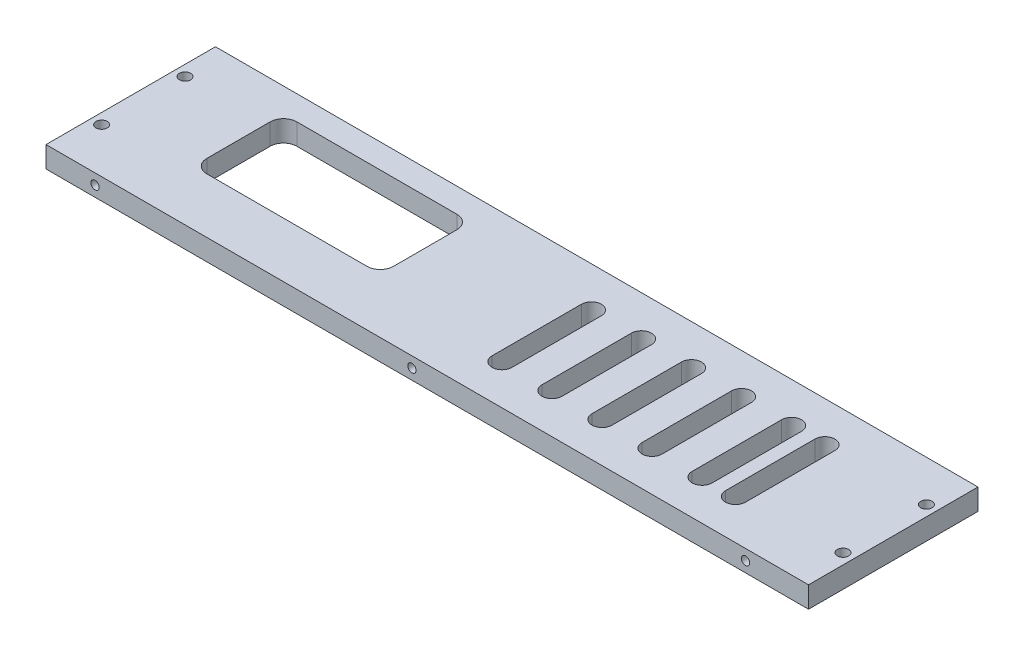
from build123d import *

# Parameters (mm, degrees)
PARED_Y_1_4IN_START          = -101.6
CROQUIS1_W                   = 228.6
CROQUIS1_H                   = 50.8
PARED_Y_1_4IN_DEPTH          = 6.35
ROSCA_M3_INFERIOR_START      = 12.7
CROQUIS2_R                   = 1.25
ROSCA_M3_INFERIOR_DEPTH      = 10
ROSCA_M3_SUPERIOR_START      = 53.5
CROQUIS3_R                   = 1.25
ROSCA_M3_SUPERIOR_DEPTH      = 10
BARRENOS_M3_ESQUINAS_START   = -101.6
CROQUIS4_R                   = 1.7
BARRENOS_M3_ESQUINAS_DEPTH   = 6.35
REFRENTADO_M3_ESQUINAS_START = -101.6
CROQUIS5_R                   = 2.9
REFRENTADO_M3_ESQUINAS_DEPTH = 3.2
VENTANA_PUERTOS_RPI5_START   = -101.6
VENTANA_PUERTOS_RPI5_DEPTH   = 6.35
RANURAS_VENTILACION_START    = -101.6
RANURAS_VENTILACION_DEPTH    = 6.35


with BuildPart() as part:
    # Croquis1 → Pared_-Y_1-4in (new body)
    with BuildSketch(Plane(origin=(0, 0, 0), x_dir=(1, 0, 0), z_dir=(0, 1, 0)).offset(PARED_Y_1_4IN_START)):
        with Locations((-25.4, -38.1)):
            Rectangle(CROQUIS1_W, CROQUIS1_H)
    extrude(amount=PARED_Y_1_4IN_DEPTH)

    # Croquis2 → Rosca_M3_inferior (cut)
    with BuildSketch(Plane.XY.offset(ROSCA_M3_INFERIOR_START)):
        with Locations((-125, -98.425)):
            Circle(CROQUIS2_R)
        with Locations((-30, -98.425)):
            Circle(CROQUIS2_R)
        with Locations((70, -98.425)):
            Circle(CROQUIS2_R)
    extrude(amount=ROSCA_M3_INFERIOR_DEPTH, mode=Mode.SUBTRACT)

    # Croquis3 → Rosca_M3_superior (cut)
    with BuildSketch(Plane.XY.offset(ROSCA_M3_SUPERIOR_START)):
        with Locations((-125, -98.425)):
            Circle(CROQUIS3_R)
        with Locations((-30, -98.425)):
            Circle(CROQUIS3_R)
        with Locations((70, -98.425)):
            Circle(CROQUIS3_R)
    extrude(amount=ROSCA_M3_SUPERIOR_DEPTH, mode=Mode.SUBTRACT)

    # Croquis4 → Barrenos_M3_esquinas (cut)
    with BuildSketch(Plane(origin=(0, 0, 0), x_dir=(1, 0, 0), z_dir=(0, 1, 0)).offset(BARRENOS_M3_ESQUINAS_START)):
        with Locations(Location((-136.525, -25, 0), (0, 0, 270))):
            Circle(CROQUIS4_R)
        with Locations(Location((-136.525, -50, 0), (0, 0, 270))):
            Circle(CROQUIS4_R)
        with Locations(Location((85.725, -25, 0), (0, 0, 270))):
            Circle(CROQUIS4_R)
        with Locations(Location((85.725, -50, 0), (0, 0, 270))):
            Circle(CROQUIS4_R)
    extrude(amount=BARRENOS_M3_ESQUINAS_DEPTH, mode=Mode.SUBTRACT)

    # Croquis5 → Refrentado_M3_esquinas (cut)
    with BuildSketch(Plane(origin=(0, 0, 0), x_dir=(1, 0, 0), z_dir=(0, 1, 0)).offset(REFRENTADO_M3_ESQUINAS_START)):
        with Locations(Location((-136.525, -25, 0), (0, 0, 270))):
            Circle(CROQUIS5_R)
        with Locations(Location((-136.525, -50, 0), (0, 0, 270))):
            Circle(CROQUIS5_R)
        with Locations(Location((85.725, -25, 0), (0, 0, 270))):
            Circle(CROQUIS5_R)
        with Locations(Location((85.725, -50, 0), (0, 0, 270))):
            Circle(CROQUIS5_R)
    extrude(amount=REFRENTADO_M3_ESQUINAS_DEPTH, mode=Mode.SUBTRACT)

    # Croquis6 → Ventana_puertos_RPi5 (cut)
    with BuildSketch(Plane(origin=(0, 0, 0), x_dir=(1, 0, 0), z_dir=(0, 1, 0)).offset(VENTANA_PUERTOS_RPI5_START)):
        with BuildLine():
            Line((-108, -47), (-60, -47))
            ThreePointArc((-60, -47), (-57.171572875, -45.828427125), (-56, -43))
            Line((-56, -43), (-56, -24))
            ThreePointArc((-56, -24), (-57.171572875, -21.171572875), (-60, -20))
            Line((-60, -20), (-108, -20))
            ThreePointArc((-108, -20), (-110.828427125, -21.171572875), (-112, -24))
            Line((-112, -24), (-112, -43))
            ThreePointArc((-112, -43), (-110.828427125, -45.828427125), (-108, -47))
        make_face()
    extrude(amount=VENTANA_PUERTOS_RPI5_DEPTH, mode=Mode.SUBTRACT)

    # Croquis7 → Ranuras_ventilacion (cut)
    with BuildSketch(Plane(origin=(0, 0, 0), x_dir=(1, 0, 0), z_dir=(0, 1, 0)).offset(RANURAS_VENTILACION_START)):
        with BuildLine():
            Line((-12, -24.7), (-12, -51.5))
            ThreePointArc((-12, -51.5), (-15, -54.5), (-18, -51.5))
            Line((-18, -51.5), (-18, -24.7))
            ThreePointArc((-18, -24.7), (-15, -21.7), (-12, -24.7))
        make_face()
        with BuildLine():
            Line((3, -24.7), (3, -51.5))
            ThreePointArc((3, -51.5), (0, -54.5), (-3, -51.5))
            Line((-3, -51.5), (-3, -24.7))
            ThreePointArc((-3, -24.7), (0, -21.7), (3, -24.7))
        make_face()
        with BuildLine():
            Line((18, -24.7), (18, -51.5))
            ThreePointArc((18, -51.5), (15, -54.5), (12, -51.5))
            Line((12, -51.5), (12, -24.7))
            ThreePointArc((12, -24.7), (15, -21.7), (18, -24.7))
        make_face()
        with BuildLine():
            Line((33, -24.7), (33, -51.5))
            ThreePointArc((33, -51.5), (30, -54.5), (27, -51.5))
            Line((27, -51.5), (27, -24.7))
            ThreePointArc((27, -24.7), (30, -21.7), (33, -24.7))
        make_face()
        with BuildLine():
            Line((48, -24.7), (48, -51.5))
            ThreePointArc((48, -51.5), (45, -54.5), (42, -51.5))
            Line((42, -51.5), (42, -24.7))
            ThreePointArc((42, -24.7), (45, -21.7), (48, -24.7))
        make_face()
        with BuildLine():
            Line((58, -24.7), (58, -51.5))
            ThreePointArc((58, -51.5), (55, -54.5), (52, -51.5))
            Line((52, -51.5), (52, -24.7))
            ThreePointArc((52, -24.7), (55, -21.7), (58, -24.7))
        make_face()
    extrude(amount=RANURAS_VENTILACION_DEPTH, mode=Mode.SUBTRACT)


solid = part.part
